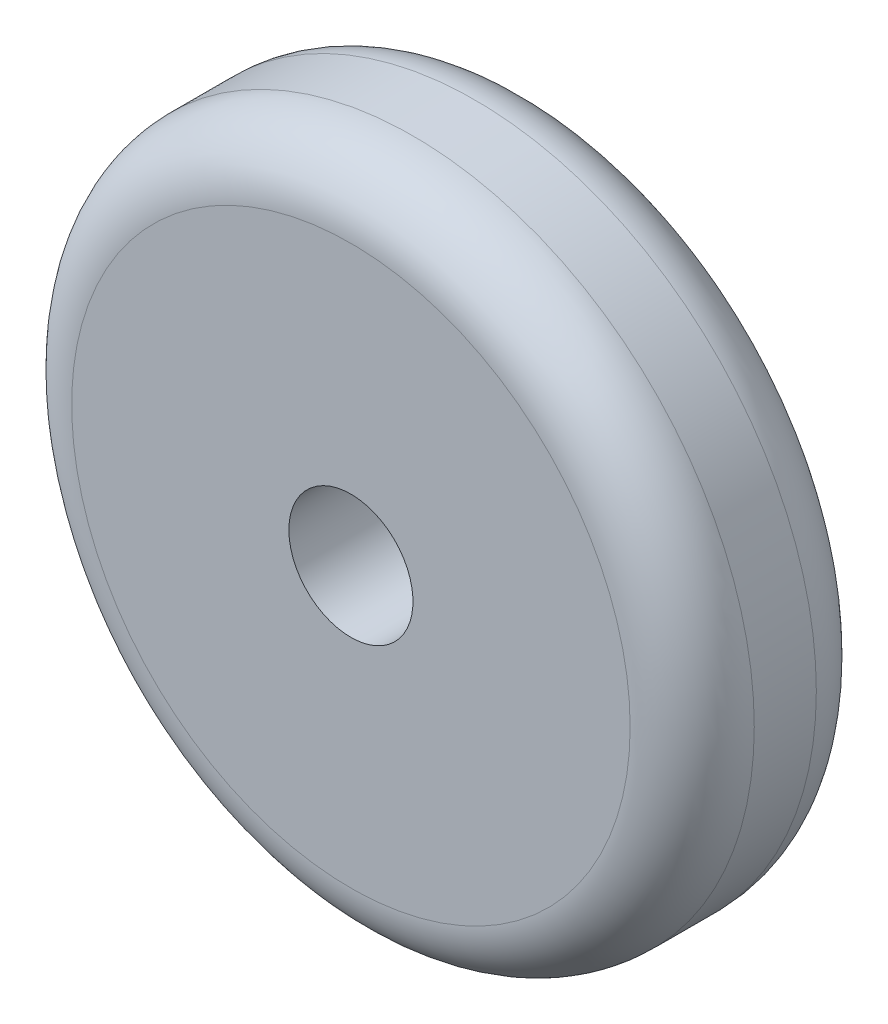
from build123d import *

# Parameters (mm, degrees)
SKETCH2_R           = 13.97
SKETCH2_R_2         = 2.54
BOSS_EXTRUDE1_DEPTH = 7.62
FILLET1_R           = 2.54


with BuildPart() as part:
    # Sketch2 → Boss-Extrude1 (new body)
    with BuildSketch(Plane.XY):
        with Locations(Location((0, 0, 0), (0, 0, 180))):
            Circle(SKETCH2_R)
        with Locations(Location((0, 0, 0), (0, 0, 180))):
            Circle(SKETCH2_R_2, mode=Mode.SUBTRACT)
    extrude(amount=BOSS_EXTRUDE1_DEPTH)

    # Fillet1
    fillet1_edges = [part.edges().sort_by_distance(p)[0] for p in [
        (13.97, 0, 0),
        (13.97, 0, 7.62),
    ]]
    fillet(fillet1_edges, radius=FILLET1_R)


solid = part.part
